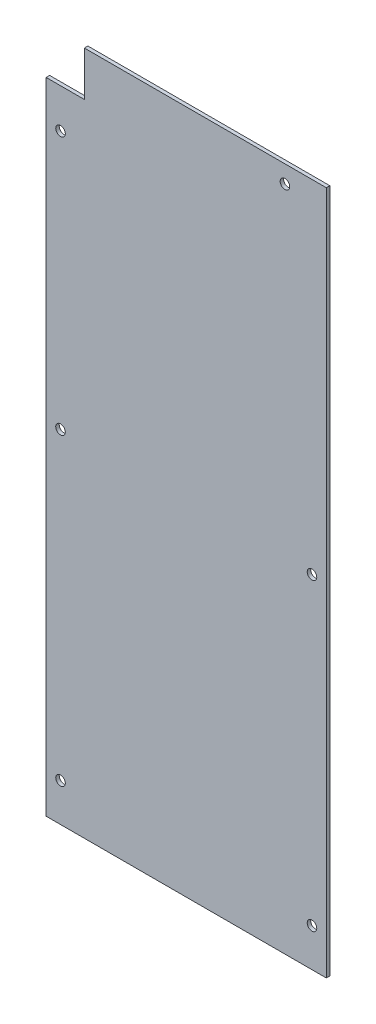
from build123d import *

# Parameters (mm, degrees)
SKETCH3_W           = 88
SKETCH3_H           = 215
BOSS_EXTRUDE3_DEPTH = 1.1
F_3DSKETCH2_R       = 1.5
CUT_EXTRUDE1_DEPTH  = 10


with BuildPart() as part:
    # Sketch3 → Boss-Extrude3 (new body)
    with BuildSketch(Plane.XY):
        with Locations((0.594511969, -70.924817192)):
            Rectangle(SKETCH3_W, SKETCH3_H)
    extrude(amount=BOSS_EXTRUDE3_DEPTH)

    # 3DSketch2 → Cut-Extrude1 (cut)
    with BuildSketch(Plane(origin=(-43.405488031, 36.575182808, 0), x_dir=(0.38040607506082663, -0.9248195597287163, 0), z_dir=(0, 0, -1))):
        with Locations(Location((26.05307815, 5.850599877, 0), (0, 0, 292.358838146))):
            Circle(F_3DSKETCH2_R)
        with Locations(Location((101.129930009, 36.73196505, 0), (0, 0, 292.358838146))):
            Circle(F_3DSKETCH2_R)
        with Locations(Location((189.450197963, 73.060745219, 0), (0, 0, 292.358838146))):
            Circle(F_3DSKETCH2_R)
        with Locations(Location((33.616963208, -67.269233567, 0), (0, 0, 292.358838146))):
            Circle(F_3DSKETCH2_R)
        with Locations(Location((131.182009938, -36.328780168, 0), (0, 0, 292.358838146))):
            Circle(F_3DSKETCH2_R)
        with Locations(Location((219.502277893, 0, 0), (0, 0, 292.358838146))):
            Circle(F_3DSKETCH2_R)
        Polygon((0, 0), (4.564872901, -11.097834717), (17.511468963, -5.772510721), (12.946596062, 5.325323996), align=None)
    extrude(amount=-CUT_EXTRUDE1_DEPTH, mode=Mode.SUBTRACT)


solid = part.part
